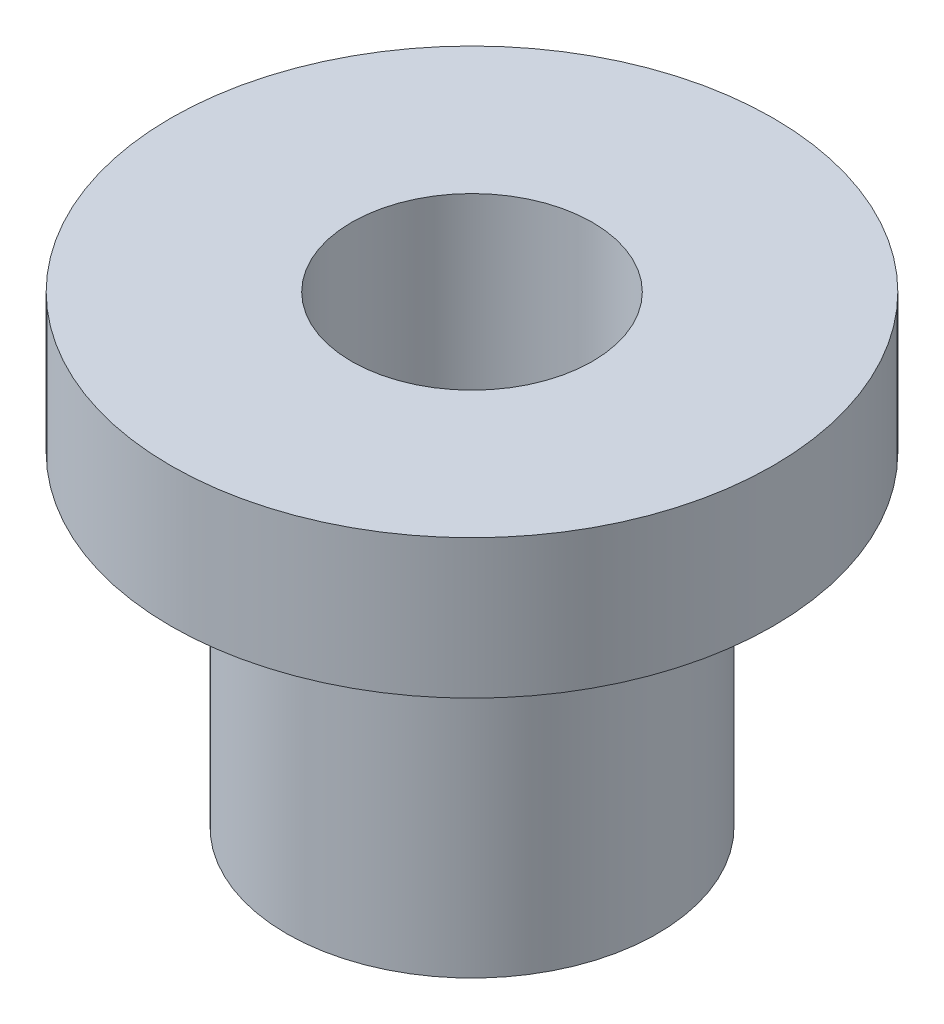
from build123d import *

# Parameters (mm, degrees)
SKETCH1_R           = 4
SKETCH1_R_2         = 2.6
BOSS_EXTRUDE1_DEPTH = 7
SKETCH2_R           = 6.5
SKETCH2_R_2         = 2.6
BOSS_EXTRUDE2_DEPTH = 3


with BuildPart() as part:
    # Sketch1 → Boss-Extrude1 (new body)
    with BuildSketch(Plane(origin=(0, 0, 0), x_dir=(1, 0, 0), z_dir=(0, 1, 0))):
        with Locations(Location((0, 0, 0), (0, 0, 270))):
            Circle(SKETCH1_R)
        with Locations(Location((0, 0, 0), (0, 0, 270))):
            Circle(SKETCH1_R_2, mode=Mode.SUBTRACT)
    extrude(amount=BOSS_EXTRUDE1_DEPTH)

    # Sketch2 → Boss-Extrude2 (add)
    with BuildSketch(Plane(origin=(0, 7, 0), x_dir=(1, 0, 0), z_dir=(0, 1, 0))):
        with Locations(Location((0, 0, 0), (0, 0, 270))):
            Circle(SKETCH2_R)
        with Locations(Location((0, 0, 0), (0, 0, 270))):
            Circle(SKETCH2_R_2, mode=Mode.SUBTRACT)
    extrude(amount=BOSS_EXTRUDE2_DEPTH)


solid = part.part
